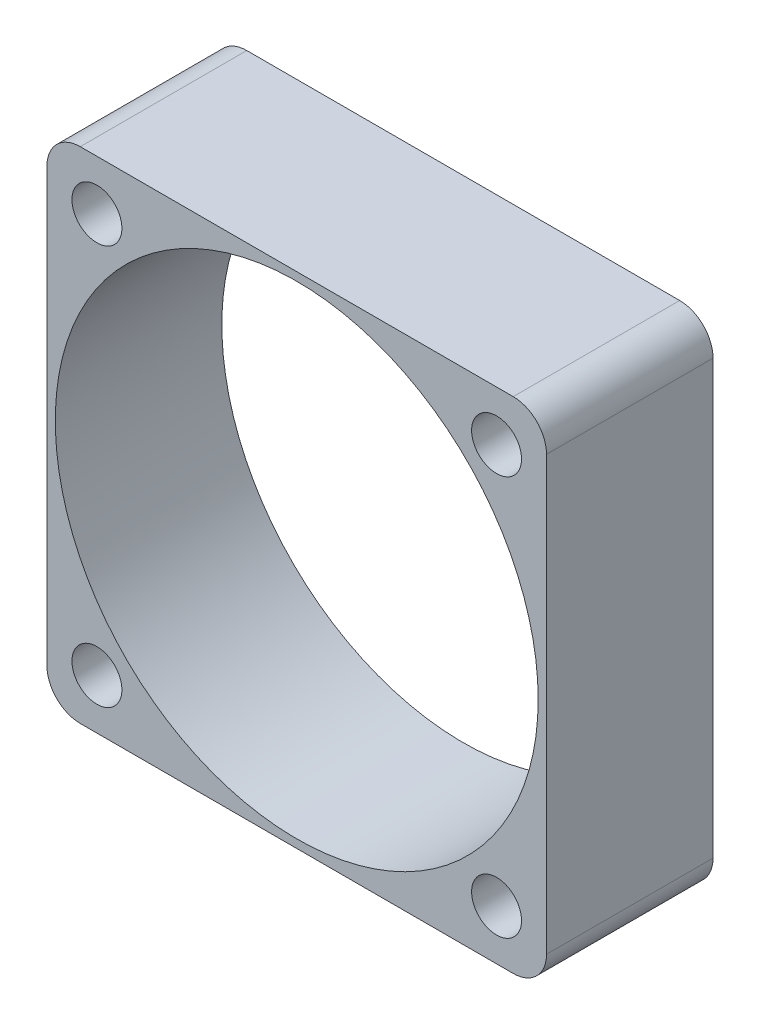
from build123d import *

# Parameters (mm, degrees)
SKETCH_1_W          = 30
SKETCH_1_H          = 30
SKETCH_1_R          = 14.5
EXTRUDE_1_DEPTH     = 10
FILLET_1_R          = 2
SKETCH_2_R          = 1.5
CUT_EXTRUDE_1_DEPTH = 10


with BuildPart() as part:
    # 草圖1 → 填料-伸長1 (new body)
    with BuildSketch(Plane.XY):
        Rectangle(SKETCH_1_W, SKETCH_1_H)
        Circle(SKETCH_1_R, mode=Mode.SUBTRACT)
    extrude(amount=EXTRUDE_1_DEPTH)

    # 圓角1
    fillet_1_edges = [part.edges().sort_by_distance(p)[0] for p in [
        (-15, 15, 5),
        (15, 15, 5),
        (15, -15, 5),
        (-15, -15, 5),
    ]]
    fillet(fillet_1_edges, radius=FILLET_1_R)

    # 草圖2 → 除料-伸長1 (cut)
    with BuildSketch(Plane.XY.offset(10)):
        with Locations((-12, 12)):
            Circle(SKETCH_2_R)
        with Locations(Location((12, 12, 0), (0, 0, 180))):
            Circle(SKETCH_2_R)
        with Locations((12, -12)):
            Circle(SKETCH_2_R)
        with Locations(Location((-12, -12, 0), (0, 0, 180))):
            Circle(SKETCH_2_R)
    extrude(amount=-CUT_EXTRUDE_1_DEPTH, mode=Mode.SUBTRACT)


solid = part.part
